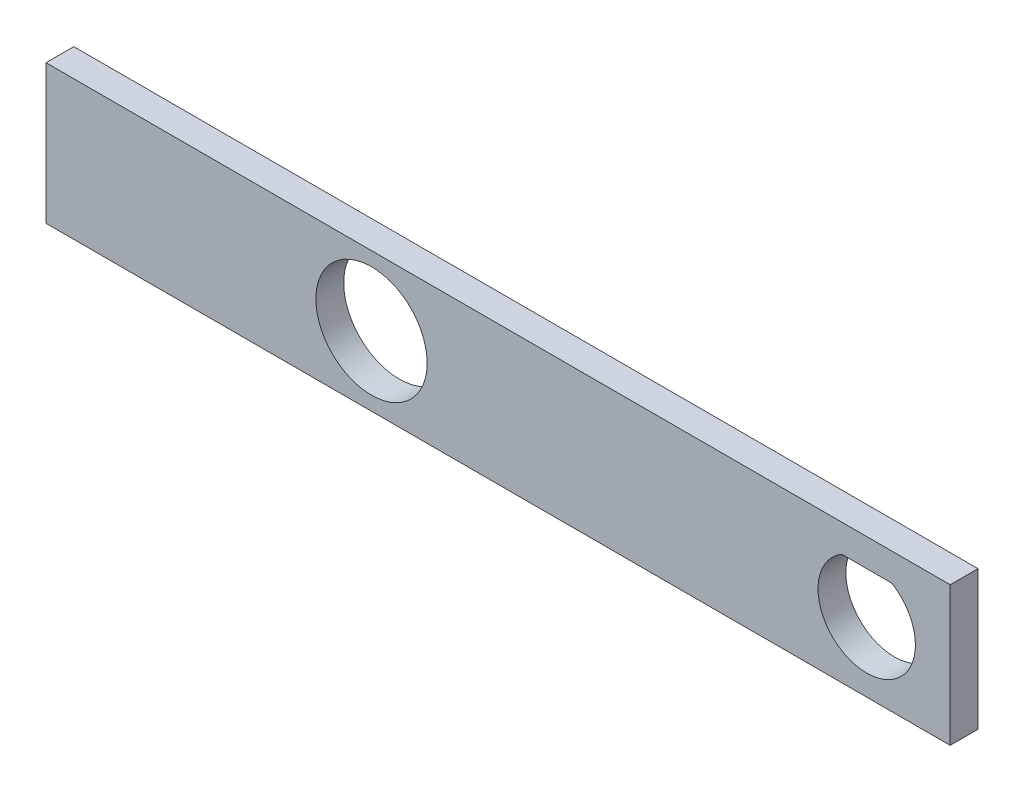
from build123d import *

# Parameters (mm, degrees)
SKETCH1_W           = 65
SKETCH1_H           = 10
SKETCH1_R           = 4
BOSS_EXTRUDE2_DEPTH = 2


with BuildPart() as part:
    # Sketch1 → Boss-Extrude2 (new body)
    with BuildSketch(Plane.XY):
        with Locations((9.1, 0)):
            Rectangle(SKETCH1_W, SKETCH1_H)
        Circle(SKETCH1_R, mode=Mode.SUBTRACT)
        with BuildLine():
            Line((33.797224362, 3), (37.402775638, 3))
            ThreePointArc((37.402775638, 3), (35.6, -3.5), (33.797224362, 3))
        make_face(mode=Mode.SUBTRACT)
    extrude(amount=BOSS_EXTRUDE2_DEPTH)


solid = part.part
